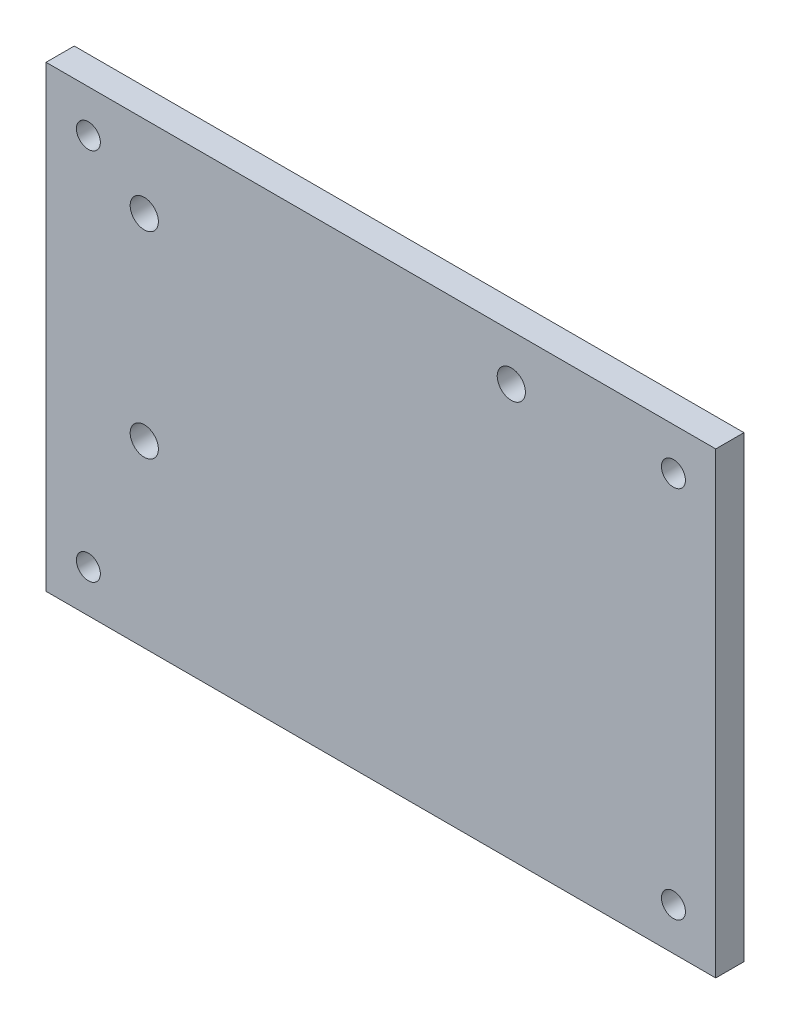
from build123d import *

# Parameters (mm, degrees)
ESQUISSE1_W             = 95
ESQUISSE1_H             = 65
BOSS_EXTRU_1_DEPTH      = 4
ESQUISSE2_R             = 1.7
ENL_V_MAT_EXTRU_1_DEPTH = 5
ESQUISSE3_R             = 2
ENL_V_MAT_EXTRU_2_DEPTH = 3


with BuildPart() as part:
    # Esquisse1 → Boss.-Extru.1 (new body)
    with BuildSketch(Plane.XY):
        Rectangle(ESQUISSE1_W, ESQUISSE1_H)
    extrude(amount=BOSS_EXTRU_1_DEPTH)

    # Esquisse2 → Enlèv. mat.-Extru.1 (cut)
    with BuildSketch(Plane(origin=(0, 0, 0), x_dir=(-1, 0, 0), z_dir=(0, 0, -1))):
        with Locations((-41.5, 26.5)):
            Circle(ESQUISSE2_R)
        with Locations(Location((41.5, 26.5, 0), (0, 0, 180))):
            Circle(ESQUISSE2_R)
        with Locations(Location((-41.5, -26.5, 0), (0, 0, 180))):
            Circle(ESQUISSE2_R)
        with Locations((41.5, -26.5)):
            Circle(ESQUISSE2_R)
    extrude(amount=-ENL_V_MAT_EXTRU_1_DEPTH, mode=Mode.SUBTRACT)

    # Esquisse3 → Enlèv. mat.-Extru.2 (cut)
    with BuildSketch(Plane.XY.offset(4)):
        with Locations((18.5, 25.96)):
            Circle(ESQUISSE3_R)
        with Locations((-33.57, 20.88)):
            Circle(ESQUISSE3_R)
        with Locations((-33.57, -7.06)):
            Circle(ESQUISSE3_R)
    extrude(amount=-ENL_V_MAT_EXTRU_2_DEPTH, mode=Mode.SUBTRACT)


solid = part.part
